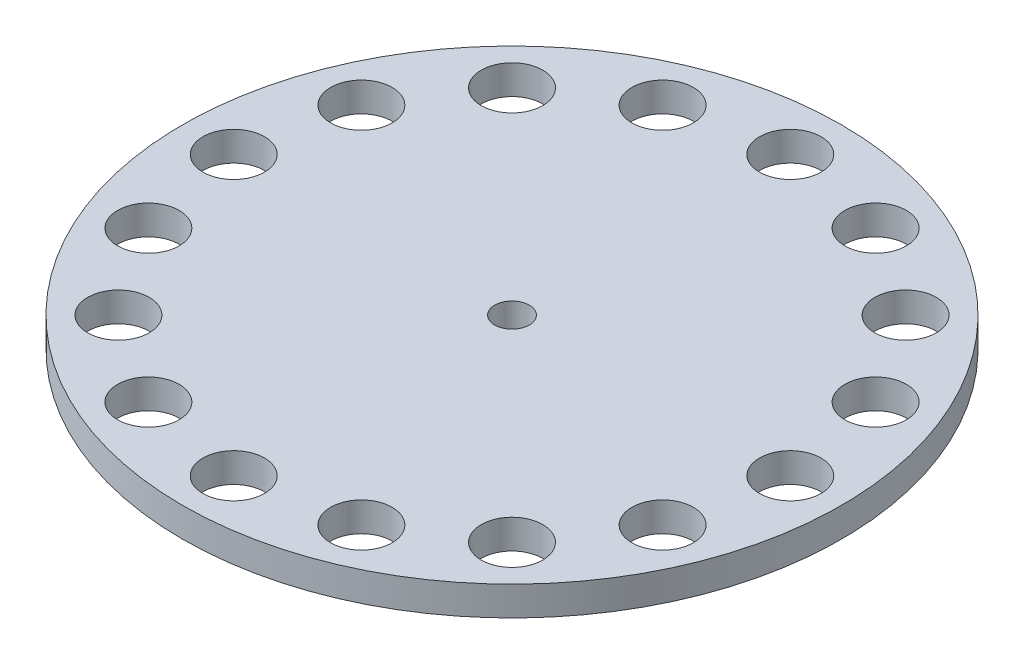
from build123d import *

# Parameters (mm, degrees)
SKETCH1_R           = 57.15
SKETCH1_R_2         = 2.9972
SKETCH1_R_3         = 5.334
BOSS_EXTRUDE1_DEPTH = 5.08


with BuildPart() as part:
    # Sketch1 → Boss-Extrude1 (new body)
    with BuildSketch(Plane(origin=(0, 0, 0), x_dir=(1, 0, 0), z_dir=(0, 1, 0))):
        with Locations(Location((0, 0, 0), (0, 0, 270))):
            Circle(SKETCH1_R)
        with Locations(Location((0, 0, 0), (0, 0, 270))):
            Circle(SKETCH1_R_2, mode=Mode.SUBTRACT)
        with Locations(Location((0, 48.26, 0), (0, 0, 270))):
            Circle(SKETCH1_R_3, mode=Mode.SUBTRACT)
        with Locations(Location((18.468302446, 44.586426239, 0), (0, 0, 270))):
            Circle(SKETCH1_R_3, mode=Mode.SUBTRACT)
        with Locations(Location((34.12497326, 34.12497326, 0), (0, 0, 270))):
            Circle(SKETCH1_R_3, mode=Mode.SUBTRACT)
        with Locations(Location((44.586426239, 18.468302446, 0), (0, 0, 270))):
            Circle(SKETCH1_R_3, mode=Mode.SUBTRACT)
        with Locations(Location((48.26, 0, 0), (0, 0, 270))):
            Circle(SKETCH1_R_3, mode=Mode.SUBTRACT)
        with Locations(Location((44.586426239, -18.468302446, 0), (0, 0, 270))):
            Circle(SKETCH1_R_3, mode=Mode.SUBTRACT)
        with Locations(Location((34.12497326, -34.12497326, 0), (0, 0, 270))):
            Circle(SKETCH1_R_3, mode=Mode.SUBTRACT)
        with Locations(Location((18.468302446, -44.586426239, 0), (0, 0, 270))):
            Circle(SKETCH1_R_3, mode=Mode.SUBTRACT)
        with Locations(Location((0, -48.26, 0), (0, 0, 270))):
            Circle(SKETCH1_R_3, mode=Mode.SUBTRACT)
        with Locations(Location((-18.468302446, -44.586426239, 0), (0, 0, 270))):
            Circle(SKETCH1_R_3, mode=Mode.SUBTRACT)
        with Locations(Location((-34.12497326, -34.12497326, 0), (0, 0, 270))):
            Circle(SKETCH1_R_3, mode=Mode.SUBTRACT)
        with Locations(Location((-44.586426239, -18.468302446, 0), (0, 0, 270))):
            Circle(SKETCH1_R_3, mode=Mode.SUBTRACT)
        with Locations(Location((-48.26, 0, 0), (0, 0, 270))):
            Circle(SKETCH1_R_3, mode=Mode.SUBTRACT)
        with Locations(Location((-44.586426239, 18.468302446, 0), (0, 0, 270))):
            Circle(SKETCH1_R_3, mode=Mode.SUBTRACT)
        with Locations(Location((-34.12497326, 34.12497326, 0), (0, 0, 270))):
            Circle(SKETCH1_R_3, mode=Mode.SUBTRACT)
        with Locations(Location((-18.468302446, 44.586426239, 0), (0, 0, 270))):
            Circle(SKETCH1_R_3, mode=Mode.SUBTRACT)
    extrude(amount=BOSS_EXTRUDE1_DEPTH)


solid = part.part
